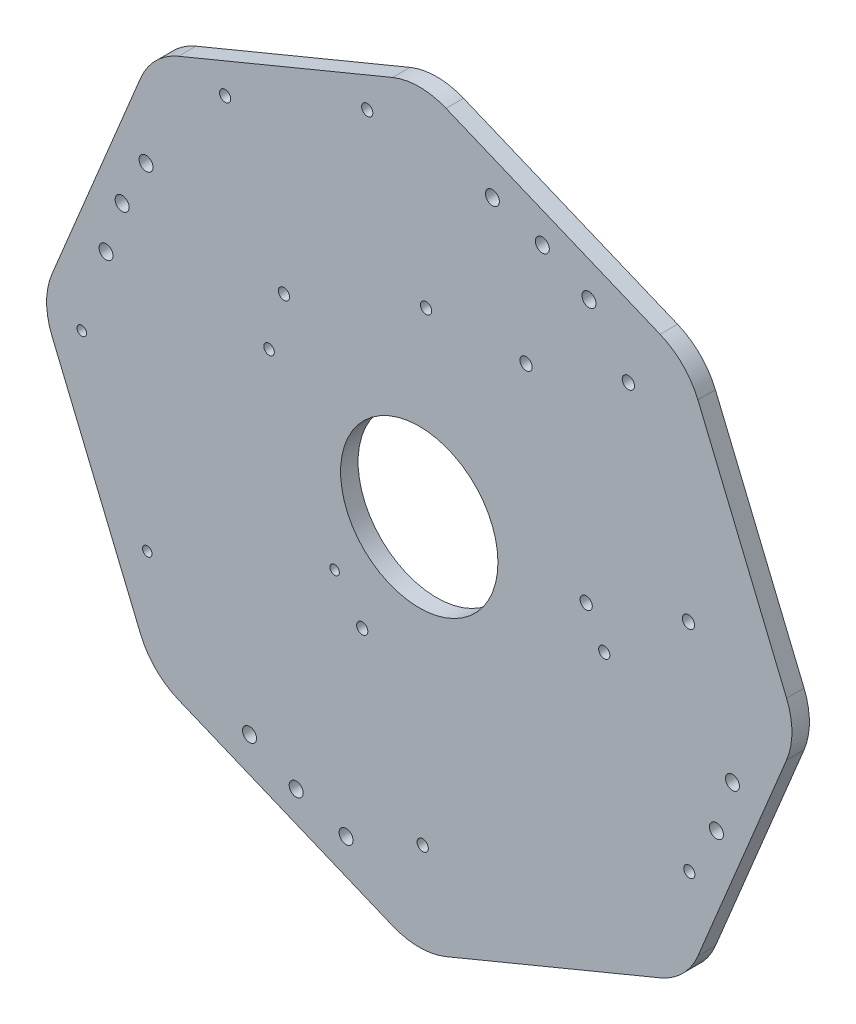
from build123d import *

# Parameters (mm, degrees)
SKETCH_1_R      = 1.6
SKETCH_1_R_2    = 2
SKETCH_1_R_3    = 22.5
SKETCH_1_R_4    = 1.75
SKETCH_1_R_5    = 1.35
SKETCH_1_R_6    = 1.5
EXTRUDE_1_DEPTH = 5
FILLET_1_R      = 20


with BuildPart() as part:
    # 草图1 → 凸台-拉伸1 (new body)
    with BuildSketch(Plane.XY):
        Polygon((0, 108.239220029), (-76.536686473, 76.536686473), (-108.239220029, 0), (-76.536686473, -76.536686473), (0, -108.239220029), (76.536686473, -76.536686473), (108.239220029, 0), (76.536686473, 76.536686473), align=None)
        with Locations((0.984871452, -80.771467909)):
            Circle(SKETCH_1_R, mode=Mode.SUBTRACT)
        with Locations((77.251126861, -49.180950568)):
            Circle(SKETCH_1_R, mode=Mode.SUBTRACT)
        with Locations((-35.206875778, -84.996916991)):
            Circle(SKETCH_1_R_2, mode=Mode.SUBTRACT)
        with Locations((84.996916991, -35.206875778)):
            Circle(SKETCH_1_R_2, mode=Mode.SUBTRACT)
        with Locations((35.206875778, 84.996916991)):
            Circle(SKETCH_1_R_2, mode=Mode.SUBTRACT)
        with Locations((-84.996916991, 35.206875778)):
            Circle(SKETCH_1_R_2, mode=Mode.SUBTRACT)
        with Locations((-16.310103988, -35.699033711)):
            Circle(SKETCH_1_R, mode=Mode.SUBTRACT)
        with Locations((52.916189383, -7.024564124)):
            Circle(SKETCH_1_R, mode=Mode.SUBTRACT)
        Circle(SKETCH_1_R_3, mode=Mode.SUBTRACT)
        with Locations((-55.532225493, 76.577881479)):
            Circle(SKETCH_1_R, mode=Mode.SUBTRACT)
        with Locations((-38.694154469, 35.927182049)):
            Circle(SKETCH_1_R, mode=Mode.SUBTRACT)
        with Locations((1.956544962, 52.765253073)):
            Circle(SKETCH_1_R, mode=Mode.SUBTRACT)
        with Locations((-14.881526062, 93.415952503)):
            Circle(SKETCH_1_R, mode=Mode.SUBTRACT)
        with Locations((89.588318422, -20.926853617)):
            Circle(SKETCH_1_R_2, mode=Mode.SUBTRACT)
        with Locations((-20.926853617, -89.588318422)):
            Circle(SKETCH_1_R_2, mode=Mode.SUBTRACT)
        with Locations((-89.588318422, 20.926853617)):
            Circle(SKETCH_1_R_2, mode=Mode.SUBTRACT)
        with Locations((20.926853617, 89.588318422)):
            Circle(SKETCH_1_R_2, mode=Mode.SUBTRACT)
        with Locations((30.543151662, 53.28256885)):
            Circle(SKETCH_1_R_4, mode=Mode.SUBTRACT)
        with Locations((59.802830282, 63.216410356)):
            Circle(SKETCH_1_R_4, mode=Mode.SUBTRACT)
        with Locations((47.742521261, 2.622607486)):
            Circle(SKETCH_1_R_4, mode=Mode.SUBTRACT)
        with Locations((77.002199881, 12.556448992)):
            Circle(SKETCH_1_R_4, mode=Mode.SUBTRACT)
        with Locations((-96.543078059, -2.105725275)):
            Circle(SKETCH_1_R_5, mode=Mode.SUBTRACT)
        with Locations((-77.791589873, -47.375822368)):
            Circle(SKETCH_1_R_5, mode=Mode.SUBTRACT)
        with Locations((-42.958065173, 20.089913802)):
            Circle(SKETCH_1_R_6, mode=Mode.SUBTRACT)
        with Locations((-24.206576987, -25.180183291)):
            Circle(SKETCH_1_R_5, mode=Mode.SUBTRACT)
        with Locations((-48.55098737, -78.146027573)):
            Circle(SKETCH_1_R_2, mode=Mode.SUBTRACT)
        with Locations((-78.146027573, 48.55098737)):
            Circle(SKETCH_1_R_2, mode=Mode.SUBTRACT)
        with Locations((48.55098737, 78.146027573)):
            Circle(SKETCH_1_R_2, mode=Mode.SUBTRACT)
    extrude(amount=EXTRUDE_1_DEPTH)

    # 圆角1
    fillet_1_edges = [part.edges().sort_by_distance(p)[0] for p in [
        (76.536686473, 76.536686473, 2.5),
        (108.239220029, 0, 2.5),
        (76.536686473, -76.536686473, 2.5),
        (0, -108.239220029, 2.5),
        (-76.536686473, -76.536686473, 2.5),
        (-108.239220029, 0, 2.5),
        (-76.536686473, 76.536686473, 2.5),
        (0, 108.239220029, 2.5),
    ]]
    fillet(fillet_1_edges, radius=FILLET_1_R)


solid = part.part
